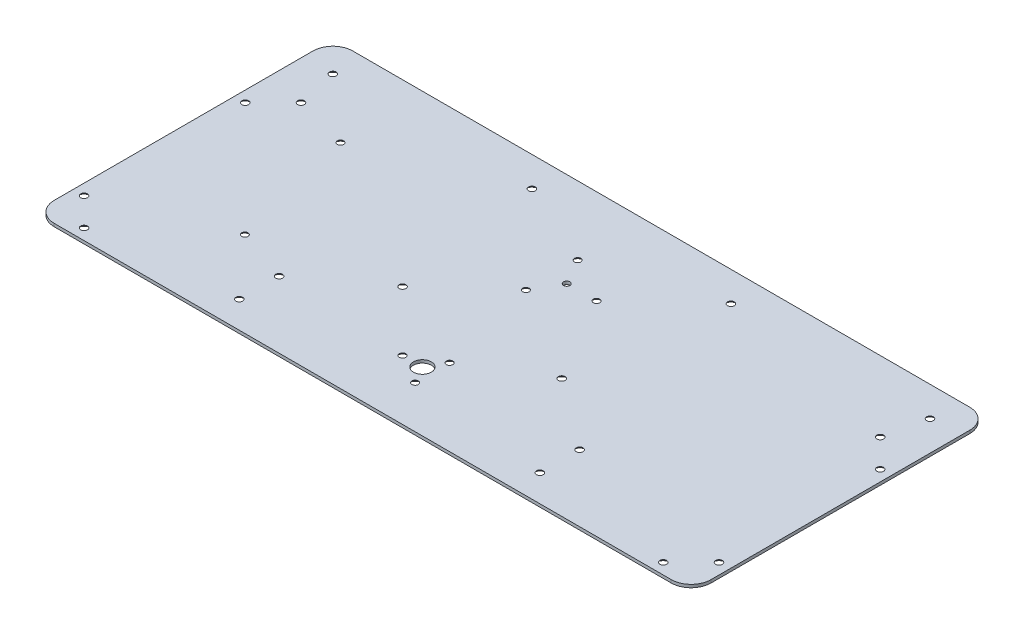
from build123d import *

# Parameters (mm, degrees)
ESQUISSE1_W                                 = 330
ESQUISSE1_H                                 = 150
ESQUISSE1_R                                 = 4.5
BOSS_EXTRU_1_DEPTH                          = 1.5
FRAISAGE_POUR_VIS_T_TE_FRAIS_E_M31_AT_COUNT = 2
FRAISAGE_POUR_VIS_T_TE_FRAIS_E_M31_AT_PITCH = 17.320508076
FRAISAGE_POUR_VIS_T_TE_FRAIS_E_M31_2_COUNT  = 2
FRAISAGE_POUR_VIS_T_TE_FRAIS_E_M31_2_PITCH  = 17.320508076
CONG_2_R                                    = 10
ESQUISSE4_R                                 = 1.6
ENL_V_MAT_EXTRU_1_DEPTH                     = 205.027571666
CHANFREIN1_SIZE                             = 1.4
FRAISAGE_POUR_VIS_T_TE_FRAIS_E_M32_AT_COUNT = 2
FRAISAGE_POUR_VIS_T_TE_FRAIS_E_M32_AT_PITCH = 20
FRAISAGE_POUR_VIS_T_TE_FRAIS_E_M32_2_COUNT  = 2
FRAISAGE_POUR_VIS_T_TE_FRAIS_E_M32_2_PITCH  = 152.318744743
FRAISAGE_POUR_VIS_T_TE_FRAIS_E_M32_3_COUNT  = 2
FRAISAGE_POUR_VIS_T_TE_FRAIS_E_M32_3_PITCH  = 151
FRAISAGE_POUR_VIS_T_TE_FRAIS_E_M32_4_COUNT  = 2
FRAISAGE_POUR_VIS_T_TE_FRAIS_E_M32_4_PITCH  = 85.158675424
FRAISAGE_POUR_VIS_T_TE_FRAIS_E_M32_5_COUNT  = 2
FRAISAGE_POUR_VIS_T_TE_FRAIS_E_M32_5_PITCH  = 75.3923073
FRAISAGE_POUR_VIS_T_TE_FRAIS_E_M32_6_COUNT  = 2
FRAISAGE_POUR_VIS_T_TE_FRAIS_E_M32_6_PITCH  = 107.447661678
FRAISAGE_POUR_VIS_T_TE_FRAIS_E_M32_7_COUNT  = 2
FRAISAGE_POUR_VIS_T_TE_FRAIS_E_M32_7_PITCH  = 107.056060081
FRAISAGE_POUR_VIS_T_TE_FRAIS_E_M32_8_COUNT  = 2
FRAISAGE_POUR_VIS_T_TE_FRAIS_E_M32_8_PITCH  = 222.766694099
FRAISAGE_POUR_VIS_T_TE_FRAIS_E_M32_9_COUNT  = 2
FRAISAGE_POUR_VIS_T_TE_FRAIS_E_M32_9_PITCH  = 235.416651917
FRAISAGE_POUR_VIS_T_TE_FRAIS_E_M32_10_COUNT = 2
FRAISAGE_POUR_VIS_T_TE_FRAIS_E_M32_10_PITCH = 235.376294473
FRAISAGE_POUR_VIS_T_TE_FRAIS_E_M32_11_COUNT = 2
FRAISAGE_POUR_VIS_T_TE_FRAIS_E_M32_11_PITCH = 244.364481871
FRAISAGE_POUR_VIS_T_TE_FRAIS_E_M32_12_COUNT = 2
FRAISAGE_POUR_VIS_T_TE_FRAIS_E_M32_12_PITCH = 125.906711497
FRAISAGE_POUR_VIS_T_TE_FRAIS_E_M32_13_COUNT = 2
FRAISAGE_POUR_VIS_T_TE_FRAIS_E_M32_13_PITCH = 104.654192463
FRAISAGE_POUR_VIS_T_TE_FRAIS_E_M32_14_COUNT = 2
FRAISAGE_POUR_VIS_T_TE_FRAIS_E_M32_14_PITCH = 44.300112867
FRAISAGE_POUR_VIS_T_TE_FRAIS_E_M32_15_COUNT = 2
FRAISAGE_POUR_VIS_T_TE_FRAIS_E_M32_15_PITCH = 118.501054848
FRAISAGE_POUR_VIS_T_TE_FRAIS_E_M32_16_COUNT = 2
FRAISAGE_POUR_VIS_T_TE_FRAIS_E_M32_16_PITCH = 161.407868458
FRAISAGE_POUR_VIS_T_TE_FRAIS_E_M32_17_COUNT = 2
FRAISAGE_POUR_VIS_T_TE_FRAIS_E_M32_17_PITCH = 247.290315217
FRAISAGE_POUR_VIS_T_TE_FRAIS_E_M32_18_COUNT = 2
FRAISAGE_POUR_VIS_T_TE_FRAIS_E_M32_18_PITCH = 357.617757774


with BuildPart() as part:
    # Esquisse1 → Boss.-Extru.1 (new body)
    with BuildSketch(Plane(origin=(0, 0, 0), x_dir=(1, 0, 0), z_dir=(0, 1, 0))):
        with Locations((0, 45)):
            Rectangle(ESQUISSE1_W, ESQUISSE1_H)
        with Locations(Location((0, 0, 0), (0, 0, 270))):
            Circle(ESQUISSE1_R, mode=Mode.SUBTRACT)
    extrude(amount=BOSS_EXTRU_1_DEPTH)

    # Esquisse3 → Fraisage pour vis à tête fraisée M31 (revolve, cut)
    with BuildSketch(Plane(origin=(5, 0, -8.660254038), x_dir=(0, 0, -1), z_dir=(1, 0, 0))):
        Polygon((0, 0), (0, 1.5), (1.6, 1.5), (1.6, 1.4), (3, 0), align=None)
    fraisage_pour_vis_t_te_frais_e_m31 = revolve(axis=Axis((5, -6.35, -8.660254038), (0, 1, 0)), mode=Mode.SUBTRACT)

    # Fraisage pour vis à tête fraisée M31 at: Fraisage pour vis à tête fraisée M31 ×2
    with Locations(*[(0, 0, i * FRAISAGE_POUR_VIS_T_TE_FRAIS_E_M31_AT_PITCH) for i in range(1, FRAISAGE_POUR_VIS_T_TE_FRAIS_E_M31_AT_COUNT)]):
        add(fraisage_pour_vis_t_te_frais_e_m31, mode=Mode.SUBTRACT)

    # Fraisage pour vis _ t_te frais_e M31 2: Fraisage pour vis à tête fraisée M31 ×2
    with Locations(*[Vector(-0.8660254037844397, 0, 0.49999999999999806) * (i * FRAISAGE_POUR_VIS_T_TE_FRAIS_E_M31_2_PITCH) for i in range(1, FRAISAGE_POUR_VIS_T_TE_FRAIS_E_M31_2_COUNT)]):
        add(fraisage_pour_vis_t_te_frais_e_m31, mode=Mode.SUBTRACT)

    # Congé2
    cong_2_edges = [part.edges().sort_by_distance(p)[0] for p in [
        (-165, 0.75, -120),
        (165, 0.75, -120),
        (165, 0.75, 30),
        (-165, 0.75, 30),
    ]]
    fillet(cong_2_edges, radius=CONG_2_R)

    # Esquisse4 → Enlèv. mat.-Extru.1 (cut, through all)
    with BuildSketch(Plane(origin=(0, 1.5, 0), x_dir=(1, 0, 0), z_dir=(0, 1, 0))):
        with Locations(Location((-102.23074819, 13.000761956, 0), (0, 0, 270))):
            Circle(ESQUISSE4_R)
        with Locations(Location((-118.1975933, 77.04027989, 0), (0, 0, 270))):
            Circle(ESQUISSE4_R)
        with Locations(Location((15, 72.5, 0), (0, 0, 270))):
            Circle(ESQUISSE4_R)
        with Locations(Location((-7.5, 85.490381057, 0), (0, 0, 270))):
            Circle(ESQUISSE4_R)
        with Locations(Location((-7.5, 59.509618943, 0), (0, 0, 270))):
            Circle(ESQUISSE4_R)
        with Locations(Location((0, 72.5, 0), (0, 0, 270))):
            Circle(ESQUISSE4_R)
    extrude(amount=-ENL_V_MAT_EXTRU_1_DEPTH, mode=Mode.SUBTRACT)

    # Chanfrein1
    chanfrein1_edges = [part.edges().sort_by_distance(p)[0] for p in [
        (-102.23074819, 0, -14.600761956),
        (-7.5, 0, -61.109618943),
        (15, 0, -74.1),
        (-7.5, 0, -87.090381057),
        (-118.1975933, 0, -78.64027989),
    ]]
    chamfer(chanfrein1_edges, length=CHANFREIN1_SIZE)

    # Esquisse6 → Fraisage pour vis à tête fraisée M32 (revolve, cut)
    with BuildSketch(Plane(origin=(75.5, 0, -3.5), x_dir=(0, 0, -1), z_dir=(1, 0, 0))):
        Polygon((0, 0), (0, 1.5), (1.7, 1.5), (1.7, 1.45), (3.15, 0), align=None)
    fraisage_pour_vis_t_te_frais_e_m32 = revolve(axis=Axis((75.5, -6.35, -3.5), (0, 1, 0)), mode=Mode.SUBTRACT)

    # Fraisage pour vis à tête fraisée M32 at: Fraisage pour vis à tête fraisée M32 ×2
    with Locations(*[(0, 0, i * FRAISAGE_POUR_VIS_T_TE_FRAIS_E_M32_AT_PITCH) for i in range(1, FRAISAGE_POUR_VIS_T_TE_FRAIS_E_M32_AT_COUNT)]):
        add(fraisage_pour_vis_t_te_frais_e_m32, mode=Mode.SUBTRACT)

    # Fraisage pour vis _ t_te frais_e M32 2: Fraisage pour vis à tête fraisée M32 ×2
    with Locations(*[Vector(-0.9913422031874387, 0, 0.1313036030711839) * (i * FRAISAGE_POUR_VIS_T_TE_FRAIS_E_M32_2_PITCH) for i in range(1, FRAISAGE_POUR_VIS_T_TE_FRAIS_E_M32_2_COUNT)]):
        add(fraisage_pour_vis_t_te_frais_e_m32, mode=Mode.SUBTRACT)

    # Fraisage pour vis _ t_te frais_e M32 3: Fraisage pour vis à tête fraisée M32 ×2
    with Locations(*[(-i * FRAISAGE_POUR_VIS_T_TE_FRAIS_E_M32_3_PITCH, 0, 0) for i in range(1, FRAISAGE_POUR_VIS_T_TE_FRAIS_E_M32_3_COUNT)]):
        add(fraisage_pour_vis_t_te_frais_e_m32, mode=Mode.SUBTRACT)

    # Fraisage pour vis _ t_te frais_e M32 4: Fraisage pour vis à tête fraisée M32 ×2
    with Locations(*[Vector(0.9863939238321435, 0, 0.1643989873053589) * (i * FRAISAGE_POUR_VIS_T_TE_FRAIS_E_M32_4_PITCH) for i in range(1, FRAISAGE_POUR_VIS_T_TE_FRAIS_E_M32_4_COUNT)]):
        add(fraisage_pour_vis_t_te_frais_e_m32, mode=Mode.SUBTRACT)

    # Fraisage pour vis _ t_te frais_e M32 5: Fraisage pour vis à tête fraisée M32 ×2
    with Locations(*[Vector(0.9284766908852593, 0, 0.3713906763541037) * (i * FRAISAGE_POUR_VIS_T_TE_FRAIS_E_M32_5_PITCH) for i in range(1, FRAISAGE_POUR_VIS_T_TE_FRAIS_E_M32_5_COUNT)]):
        add(fraisage_pour_vis_t_te_frais_e_m32, mode=Mode.SUBTRACT)

    # Fraisage pour vis _ t_te frais_e M32 6: Fraisage pour vis à tête fraisée M32 ×2
    with Locations(*[Vector(0.7817759706301133, 0, -0.6235594051454475) * (i * FRAISAGE_POUR_VIS_T_TE_FRAIS_E_M32_6_PITCH) for i in range(1, FRAISAGE_POUR_VIS_T_TE_FRAIS_E_M32_6_COUNT)]):
        add(fraisage_pour_vis_t_te_frais_e_m32, mode=Mode.SUBTRACT)

    # Fraisage pour vis _ t_te frais_e M32 7: Fraisage pour vis à tête fraisée M32 ×2
    with Locations(*[Vector(0.6538630316419344, 0, -0.7566129366142366) * (i * FRAISAGE_POUR_VIS_T_TE_FRAIS_E_M32_7_PITCH) for i in range(1, FRAISAGE_POUR_VIS_T_TE_FRAIS_E_M32_7_COUNT)]):
        add(fraisage_pour_vis_t_te_frais_e_m32, mode=Mode.SUBTRACT)

    # Fraisage pour vis _ t_te frais_e M32 8: Fraisage pour vis à tête fraisée M32 ×2
    with Locations(*[Vector(-0.9920693077275461, 0, 0.12569203898810538) * (i * FRAISAGE_POUR_VIS_T_TE_FRAIS_E_M32_8_PITCH) for i in range(1, FRAISAGE_POUR_VIS_T_TE_FRAIS_E_M32_8_COUNT)]):
        add(fraisage_pour_vis_t_te_frais_e_m32, mode=Mode.SUBTRACT)

    # Fraisage pour vis _ t_te frais_e M32 9: Fraisage pour vis à tête fraisée M32 ×2
    with Locations(*[Vector(-0.9982301510364278, 0, 0.05946903027451117) * (i * FRAISAGE_POUR_VIS_T_TE_FRAIS_E_M32_9_PITCH) for i in range(1, FRAISAGE_POUR_VIS_T_TE_FRAIS_E_M32_9_COUNT)]):
        add(fraisage_pour_vis_t_te_frais_e_m32, mode=Mode.SUBTRACT)

    # Fraisage pour vis _ t_te frais_e M32 10: Fraisage pour vis à tête fraisée M32 ×2
    with Locations(*[Vector(-0.9389220800441849, 0, -0.344129812142891) * (i * FRAISAGE_POUR_VIS_T_TE_FRAIS_E_M32_10_PITCH) for i in range(1, FRAISAGE_POUR_VIS_T_TE_FRAIS_E_M32_10_COUNT)]):
        add(fraisage_pour_vis_t_te_frais_e_m32, mode=Mode.SUBTRACT)

    # Fraisage pour vis _ t_te frais_e M32 11: Fraisage pour vis à tête fraisée M32 ×2
    with Locations(*[Vector(-0.9616782201769339, 0, -0.27418059894406194) * (i * FRAISAGE_POUR_VIS_T_TE_FRAIS_E_M32_11_PITCH) for i in range(1, FRAISAGE_POUR_VIS_T_TE_FRAIS_E_M32_11_COUNT)]):
        add(fraisage_pour_vis_t_te_frais_e_m32, mode=Mode.SUBTRACT)

    # Fraisage pour vis _ t_te frais_e M32 12: Fraisage pour vis à tête fraisée M32 ×2
    with Locations(*[Vector(0.5917079329146707, 0, -0.8061524186689808) * (i * FRAISAGE_POUR_VIS_T_TE_FRAIS_E_M32_12_PITCH) for i in range(1, FRAISAGE_POUR_VIS_T_TE_FRAIS_E_M32_12_COUNT)]):
        add(fraisage_pour_vis_t_te_frais_e_m32, mode=Mode.SUBTRACT)

    # Fraisage pour vis _ t_te frais_e M32 13: Fraisage pour vis à tête fraisée M32 ×2
    with Locations(*[Vector(-0.2436596126725799, 0, -0.9698608112261514) * (i * FRAISAGE_POUR_VIS_T_TE_FRAIS_E_M32_13_PITCH) for i in range(1, FRAISAGE_POUR_VIS_T_TE_FRAIS_E_M32_13_COUNT)]):
        add(fraisage_pour_vis_t_te_frais_e_m32, mode=Mode.SUBTRACT)

    # Fraisage pour vis _ t_te frais_e M32 14: Fraisage pour vis à tête fraisée M32 ×2
    with Locations(*[Vector(-0.8013523601360025, 0, -0.5981926068620863) * (i * FRAISAGE_POUR_VIS_T_TE_FRAIS_E_M32_14_PITCH) for i in range(1, FRAISAGE_POUR_VIS_T_TE_FRAIS_E_M32_14_COUNT)]):
        add(fraisage_pour_vis_t_te_frais_e_m32, mode=Mode.SUBTRACT)

    # Fraisage pour vis _ t_te frais_e M32 15: Fraisage pour vis à tête fraisée M32 ×2
    with Locations(*[Vector(-0.9746748680719794, 0, -0.223626701332532) * (i * FRAISAGE_POUR_VIS_T_TE_FRAIS_E_M32_15_PITCH) for i in range(1, FRAISAGE_POUR_VIS_T_TE_FRAIS_E_M32_15_COUNT)]):
        add(fraisage_pour_vis_t_te_frais_e_m32, mode=Mode.SUBTRACT)

    # Fraisage pour vis _ t_te frais_e M32 16: Fraisage pour vis à tête fraisée M32 ×2
    with Locations(*[Vector(-0.777533345798627, 0, -0.6288417099486903) * (i * FRAISAGE_POUR_VIS_T_TE_FRAIS_E_M32_16_PITCH) for i in range(1, FRAISAGE_POUR_VIS_T_TE_FRAIS_E_M32_16_COUNT)]):
        add(fraisage_pour_vis_t_te_frais_e_m32, mode=Mode.SUBTRACT)

    # Fraisage pour vis _ t_te frais_e M32 17: Fraisage pour vis à tête fraisée M32 ×2
    with Locations(*[Vector(-0.9118836692102092, 0, -0.41044874689506083) * (i * FRAISAGE_POUR_VIS_T_TE_FRAIS_E_M32_17_PITCH) for i in range(1, FRAISAGE_POUR_VIS_T_TE_FRAIS_E_M32_17_COUNT)]):
        add(fraisage_pour_vis_t_te_frais_e_m32, mode=Mode.SUBTRACT)

    # Fraisage pour vis _ t_te frais_e M32 18: Fraisage pour vis à tête fraisée M32 ×2
    with Locations(*[Vector(-0.9699587949702458, 0, 0.24326926657485654) * (i * FRAISAGE_POUR_VIS_T_TE_FRAIS_E_M32_18_PITCH) for i in range(1, FRAISAGE_POUR_VIS_T_TE_FRAIS_E_M32_18_COUNT)]):
        add(fraisage_pour_vis_t_te_frais_e_m32, mode=Mode.SUBTRACT)


solid = part.part
